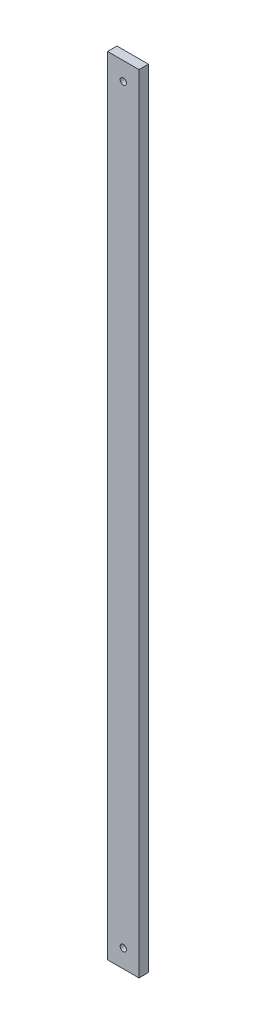
from build123d import *

# Parameters (mm, degrees)
SKETCH1_W           = 20
SKETCH1_H           = 6
BOSS_EXTRUDE1_DEPTH = 500
SKETCH2_R           = 2
CUT_EXTRUDE1_DEPTH  = 10


with BuildPart() as part:
    # Sketch1 → Boss-Extrude1 (new body)
    with BuildSketch(Plane(origin=(0, 0, 0), x_dir=(1, 0, 0), z_dir=(0, 1, 0))):
        with Locations((10, 3)):
            Rectangle(SKETCH1_W, SKETCH1_H)
    extrude(amount=BOSS_EXTRUDE1_DEPTH)

    # Sketch2 → Cut-Extrude1 (cut)
    with BuildSketch(Plane(origin=(0, 0, -6), x_dir=(-1, 0, 0), z_dir=(0, 0, -1))):
        with Locations((-10, 488.5)):
            Circle(SKETCH2_R)
        with Locations((-10, 11.5)):
            Circle(SKETCH2_R)
    extrude(amount=-CUT_EXTRUDE1_DEPTH, mode=Mode.SUBTRACT)


solid = part.part
